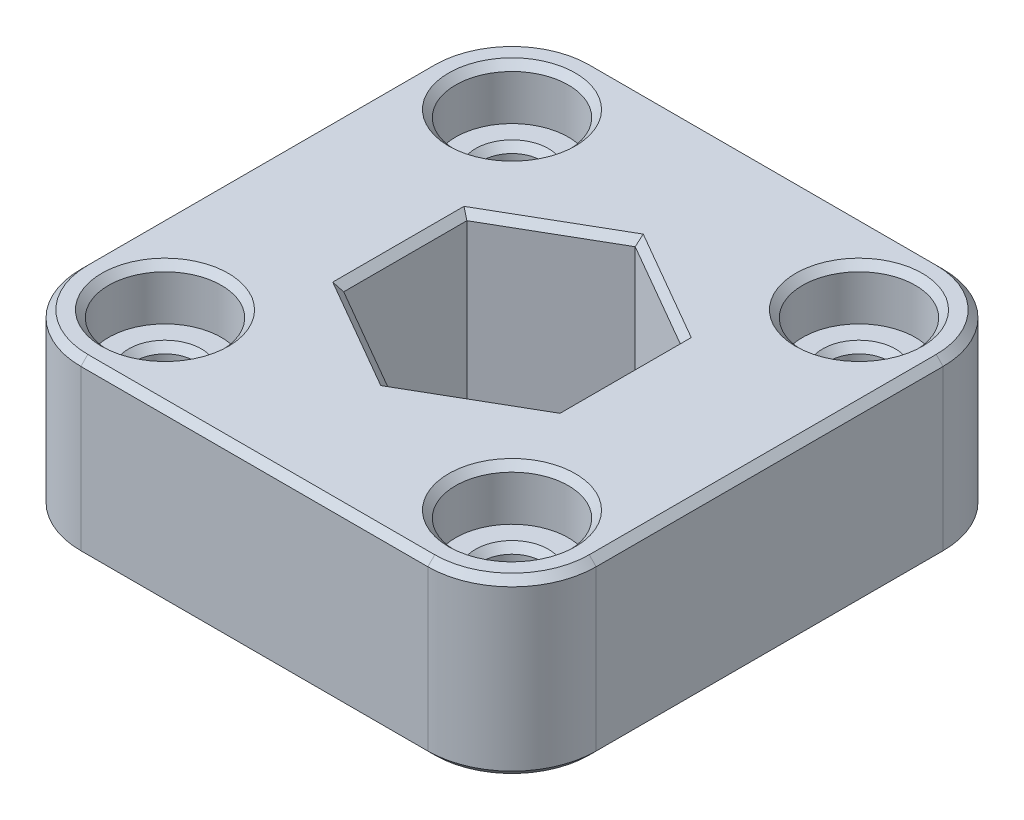
from build123d import *

# Parameters (mm, degrees)
BOSS_EXTRUDE1_DEPTH           = 10
CBORE_FOR_M3_SHCS1_AT_2_COUNT = 2
CBORE_FOR_M3_SHCS1_AT_2_PITCH = 20
CBORE_FOR_M3_SHCS1_AT_3_COUNT = 2
CBORE_FOR_M3_SHCS1_AT_3_PITCH = 28.284271247
CBORE_FOR_M3_SHCS1_AT_4_COUNT = 2
CBORE_FOR_M3_SHCS1_AT_4_PITCH = 20
CHAMFER1_SIZE                 = 0.4


with BuildPart() as part:
    # Sketch3 → Boss-Extrude1 (new body)
    with BuildSketch(Plane(origin=(0, 0, 0), x_dir=(1, 0, 0), z_dir=(0, 1, 0))):
        with BuildLine():
            Line((-14.85, -10), (-14.85, 10))
            ThreePointArc((-14.85, 10), (-13.429467889, 13.429467889), (-10, 14.85))
            Line((-10, 14.85), (10, 14.85))
            ThreePointArc((10, 14.85), (13.429467889, 13.429467889), (14.85, 10))
            Line((14.85, 10), (14.85, -10))
            ThreePointArc((14.85, -10), (13.429467889, -13.429467889), (10, -14.85))
            Line((10, -14.85), (-10, -14.85))
            ThreePointArc((-10, -14.85), (-13.429467889, -13.429467889), (-14.85, -10))
        make_face()
        Polygon((-6.15, 3.550704156), (-6.15, -3.550704156), (0, -7.101408311), (6.15, -3.550704156), (6.15, 3.550704156), (0, 7.101408311), align=None, mode=Mode.SUBTRACT)
    extrude(amount=BOSS_EXTRUDE1_DEPTH)

    # Sketch5 → CBORE for M3 SHCS1 (revolve, cut)
    with BuildSketch(Plane(origin=(-10, 10, -10), x_dir=(0, 0, 1), z_dir=(1, 0, 0))):
        Polygon((0, 0), (0, 10), (2.1, 10), (1.7, 9.6), (1.7, 3.4), (2.1, 3), (3.25, 3), (3.25, 0.4), (3.65, 0), align=None)
    cbore_for_m3_shcs1 = revolve(axis=Axis((-10, 16.35, -10), (0, -1, 0)), mode=Mode.SUBTRACT)

    # CBORE for M3 SHCS1 at 2: CBORE for M3 SHCS1 ×2
    with Locations(*[(i * CBORE_FOR_M3_SHCS1_AT_2_PITCH, 0, 0) for i in range(1, CBORE_FOR_M3_SHCS1_AT_2_COUNT)]):
        add(cbore_for_m3_shcs1, mode=Mode.SUBTRACT)

    # CBORE for M3 SHCS1 at 3: CBORE for M3 SHCS1 ×2
    with Locations(*[Vector(0.7071067811865476, 0, 0.7071067811865476) * (i * CBORE_FOR_M3_SHCS1_AT_3_PITCH) for i in range(1, CBORE_FOR_M3_SHCS1_AT_3_COUNT)]):
        add(cbore_for_m3_shcs1, mode=Mode.SUBTRACT)

    # CBORE for M3 SHCS1 at 4: CBORE for M3 SHCS1 ×2
    with Locations(*[(0, 0, i * CBORE_FOR_M3_SHCS1_AT_4_PITCH) for i in range(1, CBORE_FOR_M3_SHCS1_AT_4_COUNT)]):
        add(cbore_for_m3_shcs1, mode=Mode.SUBTRACT)

    # Chamfer1
    chamfer1_edges = [part.edges().sort_by_distance(p)[0] for p in [
        (14.85, 0, 0),
        (13.429467889, 0, 13.429467889),
        (0, 0, 14.85),
        (-13.429467889, 0, 13.429467889),
        (13.429467889, 10, 13.429467889),
        (14.85, 10, 0),
        (13.429467889, 10, -13.429467889),
        (0, 10, -14.85),
        (-3.075, 0, -5.326056233),
        (-6.15, 0, 0),
        (-3.075, 0, 5.326056233),
        (3.075, 0, 5.326056233),
        (6.15, 0, 0),
        (3.075, 0, -5.326056233),
        (-3.075, 10, -5.326056233),
        (-6.15, 10, 0),
        (-13.429467889, 10, -13.429467889),
        (-3.075, 10, 5.326056233),
        (3.075, 10, 5.326056233),
        (6.15, 10, 0),
        (3.075, 10, -5.326056233),
        (-14.85, 10, 0),
        (-13.429467889, 10, 13.429467889),
        (-14.85, 0, 0),
        (0, 10, 14.85),
        (-13.429467889, 0, -13.429467889),
        (0, 0, -14.85),
        (13.429467889, 0, -13.429467889),
    ]]
    chamfer(chamfer1_edges, length=CHAMFER1_SIZE)


solid = part.part
